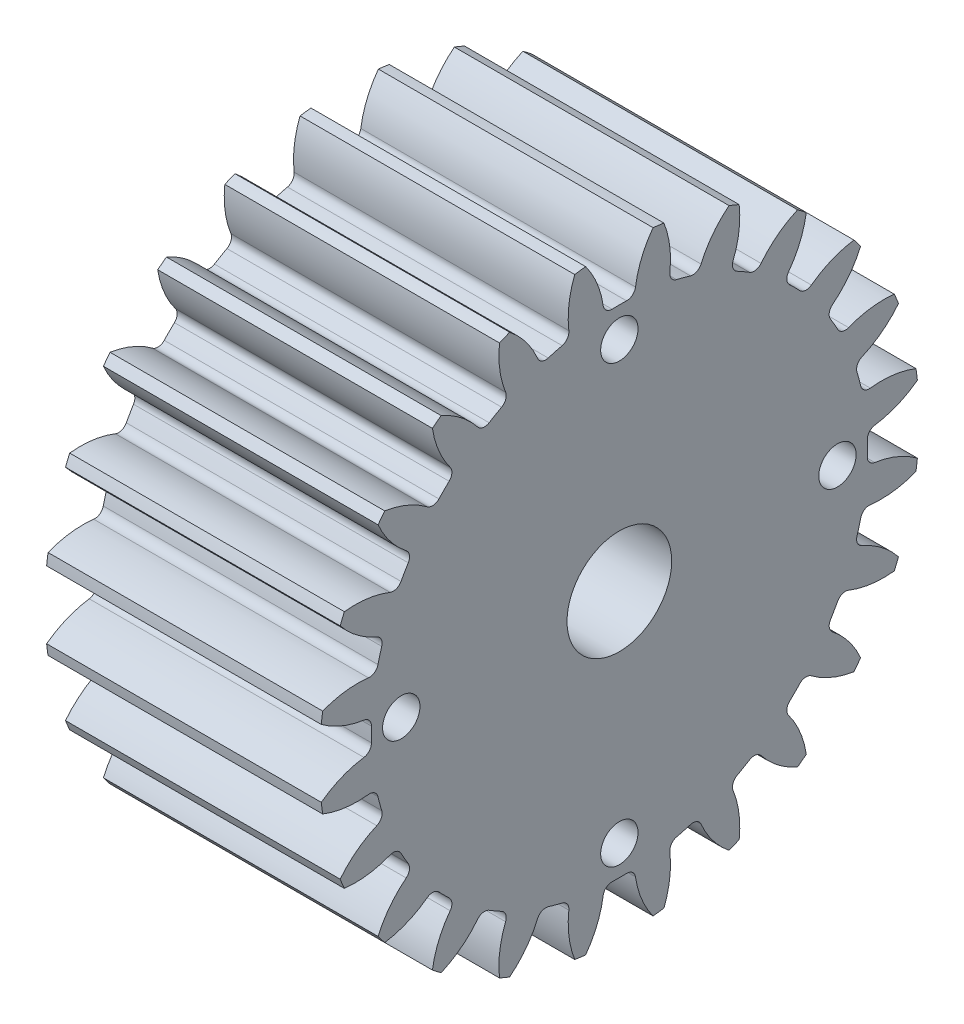
from build123d import *

# Parameters (mm, degrees)
SKETCH1_R                = 27.3
SKETCH1_R_2              = 4.7625
BOSS_EXTRUDE2_DEPTH      = 25
CUT_EXTRUDE1_DEPTH       = 46.995434556
FILLET1_R                = 0.798
CIRPATTERN2_COUNT        = 24
FILLET1_OF_CIRPATTERN2_R = 0.798
SKETCH4_R                = 1.7
CUT_EXTRUDE2_DEPTH       = 10


with BuildPart() as part:
    # Sketch1 → Boss-Extrude2 (new body)
    with BuildSketch(Plane(origin=(0, 0, 0), x_dir=(0, 0, -1), z_dir=(1, 0, 0))):
        Circle(SKETCH1_R)
        Circle(SKETCH1_R_2, mode=Mode.SUBTRACT)
    extrude(amount=BOSS_EXTRUDE2_DEPTH)

    # Sketch3 → Cut-Extrude1 (cut, through all)
    with BuildSketch(Plane(origin=(25, 0, 0), x_dir=(0, 0, -1), z_dir=(1, 0, 0))):
        with BuildLine():
            ThreePointArc((1.395272417, 22.531840579), (0, 22.575), (-1.395272417, 22.531840579))
            ThreePointArc((-1.395272417, 22.531840579), (-1.899289031, 24.95039005), (-3.067803538, 27.127082067))
            ThreePointArc((-3.067803538, 27.127082067), (0, 27.3), (3.067803538, 27.127082067))
            ThreePointArc((3.067803538, 27.127082067), (1.899289031, 24.95039005), (1.395272417, 22.531840579))
        make_face()
    cut_extrude1 = extrude(amount=-CUT_EXTRUDE1_DEPTH, mode=Mode.SUBTRACT)

    # Fillet1
    fillet1_edges = [part.edges().sort_by_distance(p)[0] for p in [
        (12.5, 22.531840579, 1.395272417),
        (12.5, 22.531840579, -1.395272417),
    ]]
    fillet(fillet1_edges, radius=FILLET1_R)

    # CirPattern2: Cut-Extrude1 ×24 about axis
    cirpattern2_axis = Axis((0, 0, 0), (1, 0, 0))
    for i in range(1, CIRPATTERN2_COUNT):
        add(cut_extrude1.rotate(cirpattern2_axis, i * 360 / CIRPATTERN2_COUNT), mode=Mode.SUBTRACT)

    # Fillet1 of CirPattern2
    fillet1_of_cirpattern2_edges = [part.edges().sort_by_distance(p)[0] for p in [
        (12.5, 21.402963655, 7.179399126),
        (12.5, 22.125209804, 4.483939801),
        (12.5, 18.815510127, 12.474261648),
        (12.5, 20.210782544, 10.057578931),
        (12.5, 14.945810678, 16.919023854),
        (12.5, 16.919023854, 14.945810678),
        (12.5, 10.057578931, 20.210782544),
        (12.5, 12.474261648, 18.815510127),
        (12.5, 4.483939801, 22.125209804),
        (12.5, 7.179399126, 21.402963655),
        (12.5, -1.395272417, 22.531840579),
        (12.5, 1.395272417, 22.531840579),
        (12.5, -7.179399126, 21.402963655),
        (12.5, -4.483939801, 22.125209804),
        (12.5, -12.474261648, 18.815510127),
        (12.5, -10.057578931, 20.210782544),
        (12.5, -16.919023854, 14.945810678),
        (12.5, -14.945810678, 16.919023854),
        (12.5, -20.210782544, 10.057578931),
        (12.5, -18.815510127, 12.474261648),
        (12.5, -22.125209804, 4.483939801),
        (12.5, -21.402963655, 7.179399126),
        (12.5, -22.531840579, -1.395272417),
        (12.5, -22.531840579, 1.395272417),
        (12.5, -21.402963655, -7.179399126),
        (12.5, -22.125209804, -4.483939801),
        (12.5, -18.815510127, -12.474261648),
        (12.5, -20.210782544, -10.057578931),
        (12.5, -14.945810678, -16.919023854),
        (12.5, -16.919023854, -14.945810678),
        (12.5, -10.057578931, -20.210782544),
        (12.5, -12.474261648, -18.815510127),
        (12.5, -4.483939801, -22.125209804),
        (12.5, -7.179399126, -21.402963655),
        (12.5, 1.395272417, -22.531840579),
        (12.5, -1.395272417, -22.531840579),
        (12.5, 7.179399126, -21.402963655),
        (12.5, 4.483939801, -22.125209804),
        (12.5, 12.474261648, -18.815510127),
        (12.5, 10.057578931, -20.210782544),
        (12.5, 16.919023854, -14.945810678),
        (12.5, 14.945810678, -16.919023854),
        (12.5, 20.210782544, -10.057578931),
        (12.5, 18.815510127, -12.474261648),
        (12.5, 22.125209804, -4.483939801),
        (12.5, 21.402963655, -7.179399126),
    ]]
    fillet(fillet1_of_cirpattern2_edges, radius=FILLET1_OF_CIRPATTERN2_R)

    # Sketch4 → Cut-Extrude2 (cut)
    with BuildSketch(Plane(origin=(25, 0, 0), x_dir=(0, 0, -1), z_dir=(1, 0, 0))):
        with Locations((0, 19.8501)):
            Circle(SKETCH4_R)
        with Locations((19.8501, 0)):
            Circle(SKETCH4_R)
        with Locations((0, -19.8501)):
            Circle(SKETCH4_R)
        with Locations((-19.8501, 0)):
            Circle(SKETCH4_R)
    extrude(amount=-CUT_EXTRUDE2_DEPTH, mode=Mode.SUBTRACT)


solid = part.part
